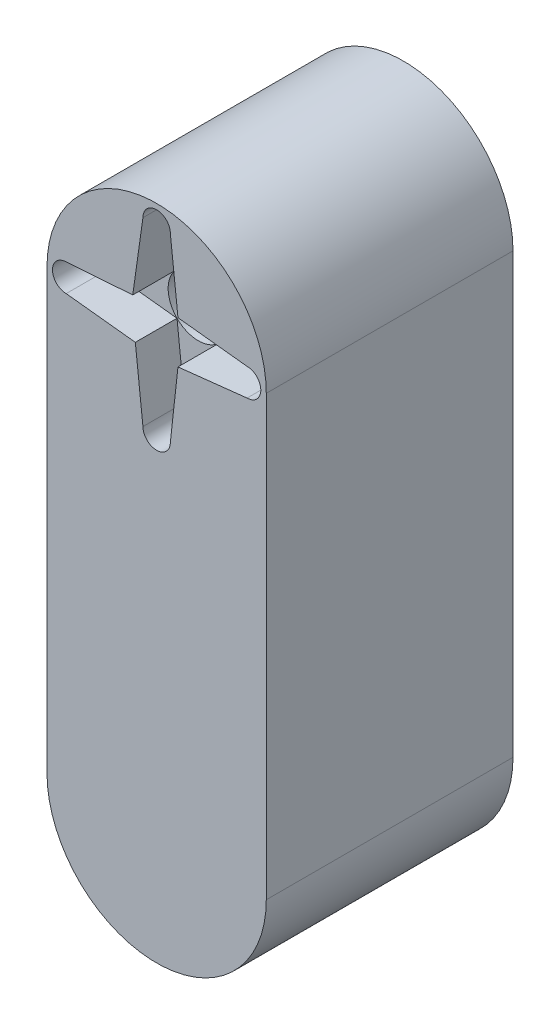
from build123d import *

# Parameters (mm, degrees)
CROQUIS1_R                = 20
SALIENTE_EXTRUIR1_DEPTH   = 45
SALIENTE_EXTRUIR1_2_DEPTH = 45
CROQUIS2_W                = 40
CROQUIS2_H                = 80
SALIENTE_EXTRUIR2_DEPTH   = 45
CORTAR_EXTRUIR2_DEPTH     = 7.6
CROQUIS4_R                = 5.5
CORTAR_EXTRUIR3_DEPTH     = 50
CROQUIS5_W                = 20
CROQUIS5_H                = 40
CORTAR_EXTRUIR4_DEPTH     = 40
CROQUIS6_W                = 20
CROQUIS6_H                = 6.5
CROQUIS6_H_2              = 7
CORTAR_EXTRUIR5_DEPTH     = 12
CORTAR_EXTRUIR6_START     = -27
CROQUIS7_W                = 20
CROQUIS7_H                = 13.910937509
CORTAR_EXTRUIR6_DEPTH     = 12


with BuildPart() as part:
    # Croquis1 → Saliente-Extruir1 (new body)
    with BuildSketch(Plane(origin=(0, 0, 0), x_dir=(0, 1, 0), z_dir=(0, 0, 1))):
        with Locations(Location((-40, 0, 0), (0, 0, 90))):
            Circle(CROQUIS1_R)
    extrude(amount=SALIENTE_EXTRUIR1_DEPTH)



with BuildPart() as body_2:
    # Croquis1 → Saliente-Extruir1 2 (new body)
    with BuildSketch(Plane(origin=(0, 0, 0), x_dir=(0, 1, 0), z_dir=(0, 0, 1))):
        with Locations(Location((40, 0, 0), (0, 0, 90))):
            Circle(CROQUIS1_R)
    extrude(amount=SALIENTE_EXTRUIR1_2_DEPTH)


with BuildPart() as part_1:
    add(part.part)

    add(body_2.part)  # Saliente-Extruir2 merges body 2
    # Croquis2 → Saliente-Extruir2 (add)
    with BuildSketch(Plane.XY.offset(45)):
        Rectangle(CROQUIS2_W, CROQUIS2_H)
    extrude(amount=-SALIENTE_EXTRUIR2_DEPTH)

    # Croquis3 → Cortar-Extruir2 (cut)
    with BuildSketch(Plane.XY.offset(45)):
        with BuildLine():
            Line((-16.5, 42.5), (-4.355962306, 43.357914886))
            Line((-4.355962306, 43.357914886), (-2.5, 56.5))
            ThreePointArc((-2.5, 56.5), (0, 59), (2.5, 56.5))
            Line((2.5, 56.5), (3.889087297, 43.889087297))
            Line((3.889087297, 43.889087297), (16.5, 42.5))
            ThreePointArc((16.5, 42.5), (19, 40), (16.5, 37.5))
            Line((16.5, 37.5), (3.889087297, 36.110912703))
            Line((3.889087297, 36.110912703), (2.5, 23.5))
            ThreePointArc((2.5, 23.5), (0, 21), (-2.5, 23.5))
            Line((-2.5, 23.5), (-3.889087297, 36.110912703))
            Line((-3.889087297, 36.110912703), (-16.5, 37.5))
            ThreePointArc((-16.5, 37.5), (-19, 40), (-16.5, 42.5))
        make_face()
    extrude(amount=-CORTAR_EXTRUIR2_DEPTH, mode=Mode.SUBTRACT)

    # Croquis4 → Cortar-Extruir3 (cut)
    with BuildSketch(Plane.XY.offset(45)):
        with Locations((0, 40)):
            Circle(CROQUIS4_R)
    extrude(amount=-CORTAR_EXTRUIR3_DEPTH, mode=Mode.SUBTRACT)

    # Croquis5 → Cortar-Extruir4 (cut)
    with BuildSketch(Plane(origin=(0, 0, 0), x_dir=(1, 0, 0), z_dir=(0, 0, -1))):
        with Locations((0, 30)):
            Rectangle(CROQUIS5_W, CROQUIS5_H)
    extrude(amount=-CORTAR_EXTRUIR4_DEPTH, mode=Mode.SUBTRACT)

    # Croquis6 → Cortar-Extruir5 (cut)
    with BuildSketch(Plane(origin=(0, 0, 0), x_dir=(1, 0, 0), z_dir=(0, 0, -1))):
        with Locations((0, 53.25)):
            Rectangle(CROQUIS6_W, CROQUIS6_H)
        with Locations((0, 6.5)):
            Rectangle(CROQUIS6_W, CROQUIS6_H_2)
    extrude(amount=-CORTAR_EXTRUIR5_DEPTH, mode=Mode.SUBTRACT)

    # Croquis7 → Cortar-Extruir6 (cut)
    with BuildSketch(Plane(origin=(0, 0, 0), x_dir=(1, 0, 0), z_dir=(0, 0, -1)).offset(CORTAR_EXTRUIR6_START)):
        with Locations((0, 56.955468755)):
            Rectangle(CROQUIS7_W, CROQUIS7_H)
    extrude(amount=-CORTAR_EXTRUIR6_DEPTH, mode=Mode.SUBTRACT)


solid = part_1.part
